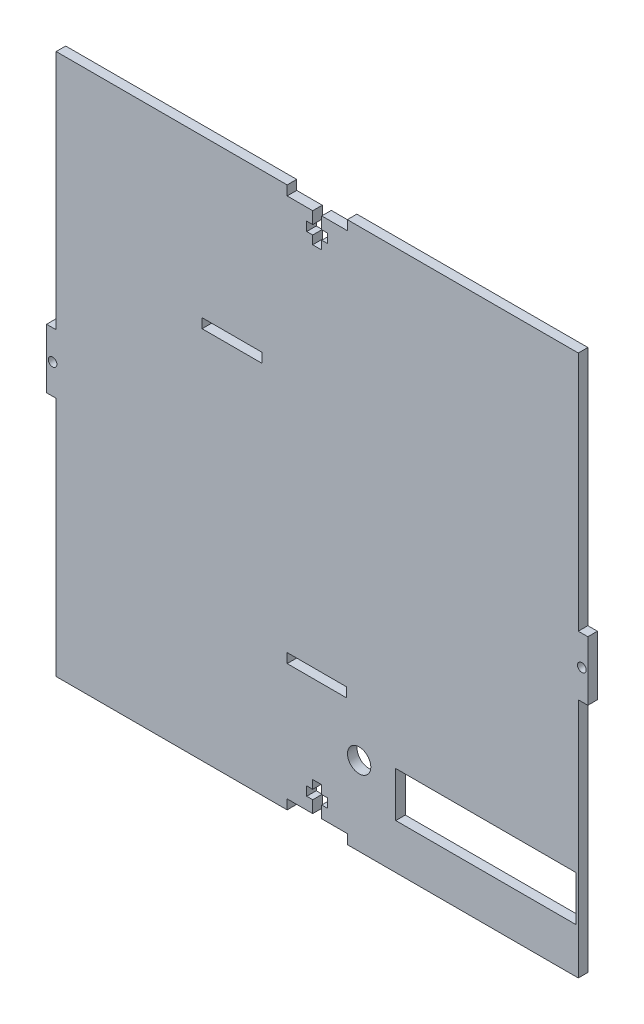
from build123d import *

# Parameters (mm, degrees)
SKETCH3_W           = 180
SKETCH3_H           = 180
SKETCH3_R           = 3.875
SKETCH3_W_2         = 20
SKETCH3_H_2         = 3.18
SKETCH3_W_3         = 19.75
SKETCH3_W_4         = 60
SKETCH3_H_3         = 15
BOSS_EXTRUDE1_DEPTH = 3.18
CUT_EXTRUDE1_DEPTH  = 128.318939675
SKETCH5_R           = 1.436023081
SKETCH5_W           = 3.18
SKETCH5_H           = 80.125
CUT_EXTRUDE2_DEPTH  = 128.318939675


with BuildPart() as part:
    # Sketch3 → Boss-Extrude1 (new body)
    with BuildSketch(Plane.XY):
        Rectangle(SKETCH3_W, SKETCH3_H)
        with Locations(Location((13.938719016, -63.758151241, 0), (0, 0, 180))):
            Circle(SKETCH3_R, mode=Mode.SUBTRACT)
        with Locations((-28.286899392, 36.024803222)):
            Rectangle(SKETCH3_W_2, SKETCH3_H_2, mode=Mode.SUBTRACT)
        with Locations((-0.125, -46.269729843)):
            Rectangle(SKETCH3_W_3, SKETCH3_H_2, mode=Mode.SUBTRACT)
        with Locations((56.112903479, -67.514680034)):
            Rectangle(SKETCH3_W_4, SKETCH3_H_3, mode=Mode.SUBTRACT)
    extrude(amount=BOSS_EXTRUDE1_DEPTH)

    # Sketch4 → Cut-Extrude1 (cut, through all)
    with BuildSketch(Plane.XY.offset(3.18)):
        Polygon((1.5, 86.82), (10, 86.82), (10, 90), (-10, 90), (-10, 86.82), (-1.5, 86.82), (-1.5, 82.82), (-3.5, 82.82), (-3.5, 79.82), (-1.5, 79.82), (-1.5, 77), (1.5, 77), (1.5, 79.82), (3.5, 79.82), (3.5, 82.82), (1.5, 82.82), align=None)
        Polygon((1.5, -79.82), (1.5, -77), (-1.5, -77), (-1.5, -79.82), (-3.5, -79.82), (-3.5, -82.82), (-1.5, -82.82), (-1.5, -86.82), (-10, -86.82), (-10, -90), (10, -90), (10, -86.82), (1.5, -86.82), (1.5, -82.82), (3.5, -82.82), (3.5, -79.82), align=None)
    extrude(amount=-CUT_EXTRUDE1_DEPTH, mode=Mode.SUBTRACT)

    # Sketch5 → Cut-Extrude2 (cut, through all)
    with BuildSketch(Plane.XY.offset(3.18)):
        with Locations((-88, 0)):
            Circle(SKETCH5_R)
        with Locations((88, 0)):
            Circle(SKETCH5_R)
        with Locations((-88.41, 49.9375)):
            Rectangle(SKETCH5_W, SKETCH5_H)
        with Locations((-88.41, -49.9375)):
            Rectangle(SKETCH5_W, SKETCH5_H)
        with Locations((88.41, -49.9375)):
            Rectangle(SKETCH5_W, SKETCH5_H)
        with Locations((88.41, 49.9375)):
            Rectangle(SKETCH5_W, SKETCH5_H)
    extrude(amount=-CUT_EXTRUDE2_DEPTH, mode=Mode.SUBTRACT)


solid = part.part
